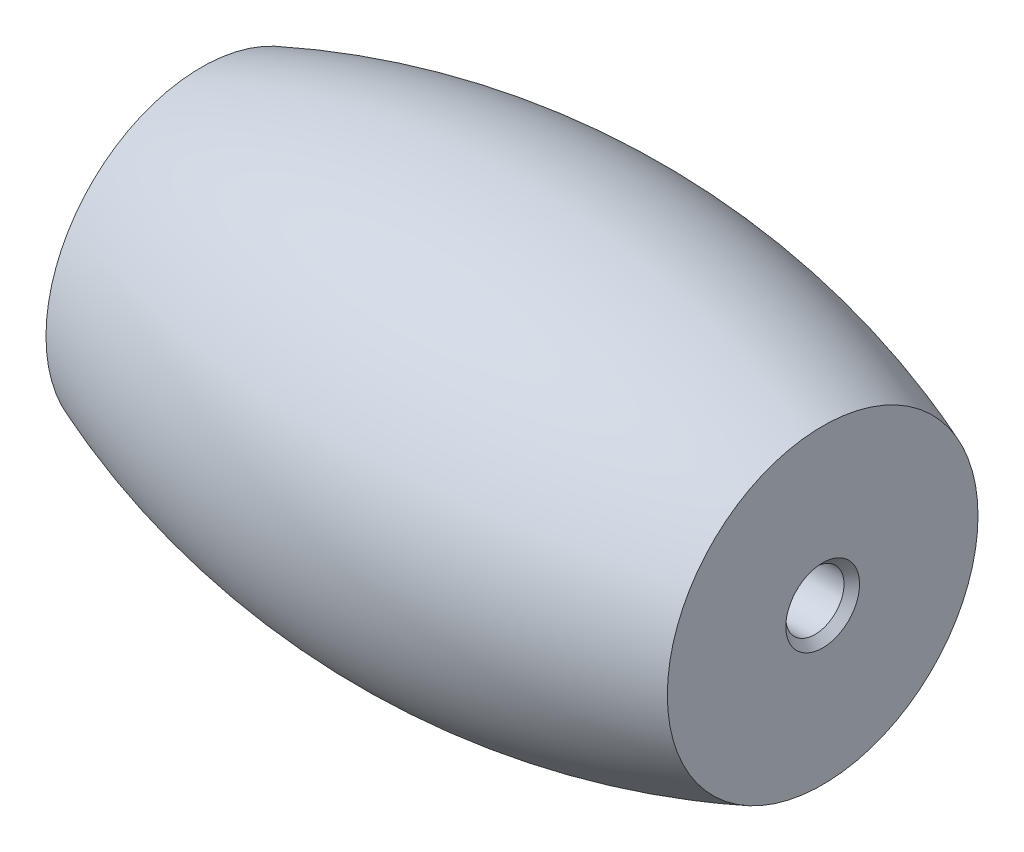
from build123d import *

# Parameters (mm, degrees)
CROQUIS2_R            = 0.75
CORTAR_EXTRUIR1_DEPTH = 16
CHAFL_N1_SIZE         = 0.2


with BuildPart() as part:
    # Croquis1 → Revolución1 (revolve)
    with BuildSketch(Plane.XY, mode=Mode.PRIVATE) as revoluci_n1_sk:
        with BuildLine():
            Line((-8, 20.579757044), (-8, 16.579757044))
            Line((-8, 16.579757044), (8, 16.579757044))
            Line((8, 16.579757044), (8, 20.579757044))
            ThreePointArc((8, 20.579757044), (0, 22.08), (-8, 20.579757044))
        make_face()
    revolve(revoluci_n1_sk.sketch.rotate(Axis((-8, 16.579757044, 0), (1, 0, 0)), 90), axis=Axis((-8, 16.579757044, 0), (1, 0, 0)))

    # Croquis2 → Cortar-Extruir1 (cut)
    with BuildSketch(Plane.ZY.offset(8)):
        with Locations((0, 16.579757044)):
            Circle(CROQUIS2_R)
    extrude(amount=-CORTAR_EXTRUIR1_DEPTH, mode=Mode.SUBTRACT)

    # Chaflán1
    chafl_n1_edges = [part.edges().sort_by_distance(p)[0] for p in [
        (-8, 16.579757044, -0.75),
        (8, 16.579757044, -0.75),
    ]]
    chamfer(chafl_n1_edges, length=CHAFL_N1_SIZE)


solid = part.part
